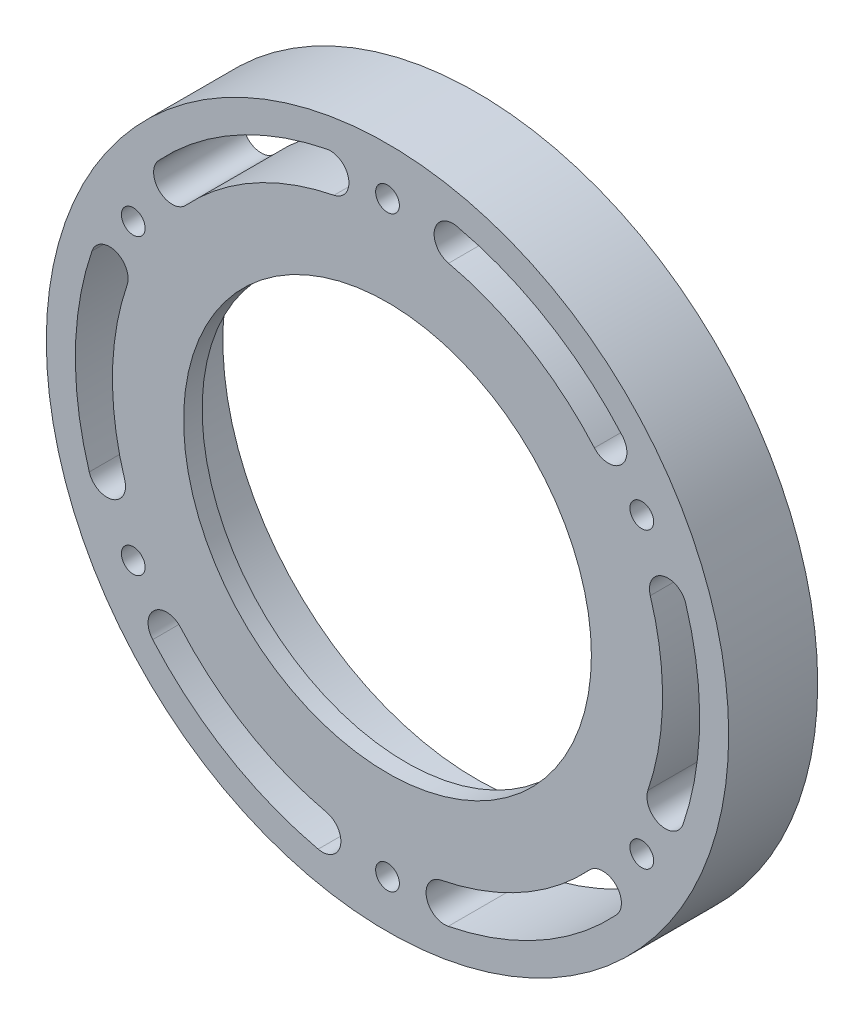
from build123d import *

# Parameters (mm, degrees)
SKETCH_1_R      = 46
SKETCH_1_R_2    = 34.2
SKETCH_1_R_3    = 1.6
EXTRUDE_1_DEPTH = 12
EXTRUDE_START   = -2.5
SKETCH_4_R      = 34.2
SKETCH_4_R_2    = 27.488330285
EXTRUDE_2_DEPTH = 2.5


with BuildPart() as part:
    # 草图1 → 凸台-拉伸1 (new body)
    with BuildSketch(Plane.XY):
        Circle(SKETCH_1_R)
        Circle(SKETCH_1_R_2, mode=Mode.SUBTRACT)
        with Locations((0, 39.58306587)):
            Circle(SKETCH_1_R_3, mode=Mode.SUBTRACT)
        with Locations((34.279940603, 19.791532935)):
            Circle(SKETCH_1_R_3, mode=Mode.SUBTRACT)
        with Locations((34.279940603, -19.791532935)):
            Circle(SKETCH_1_R_3, mode=Mode.SUBTRACT)
        with Locations((0, -39.58306587)):
            Circle(SKETCH_1_R_3, mode=Mode.SUBTRACT)
        with Locations((-34.279940603, -19.791532935)):
            Circle(SKETCH_1_R_3, mode=Mode.SUBTRACT)
        with Locations((-34.279940603, 19.791532935)):
            Circle(SKETCH_1_R_3, mode=Mode.SUBTRACT)
        with BuildLine():
            ThreePointArc((-8.185543448, 41.279308515), (-20.527703984, 36.736872515), (-30.865032605, 28.606541127))
            ThreePointArc((-30.865032605, 28.606541127), (-30.730863942, 25.073553897), (-27.197876712, 25.20772256))
            ThreePointArc((-27.197876712, 25.20772256), (-18.088753356, 32.372067841), (-7.212997452, 36.374805045))
            ThreePointArc((-7.212997452, 36.374805045), (-5.247018715, 39.313329778), (-8.185543448, 41.279308515))
        make_face(mode=Mode.SUBTRACT)
        with BuildLine():
            ThreePointArc((31.6561581, 27.728542827), (21.551212861, 36.145949389), (9.341475028, 41.033172889))
            ThreePointArc((9.341475028, 41.033172889), (6.348902667, 39.150485803), (8.231589753, 36.157913442))
            ThreePointArc((8.231589753, 36.157913442), (18.990656446, 31.85135385), (27.895006501, 24.434041553))
            ThreePointArc((27.895006501, 24.434041553), (31.422832938, 24.200716391), (31.6561581, 27.728542827))
        make_face(mode=Mode.SUBTRACT)
        with BuildLine():
            ThreePointArc((39.841701549, -13.550765687), (42.078916845, -0.590923126), (40.206507633, 12.426631761))
            ThreePointArc((40.206507633, 12.426631761), (37.079766609, 14.076931906), (35.429466465, 10.950190881))
            ThreePointArc((35.429466465, 10.950190881), (37.079409802, -0.520713992), (35.108003953, -11.940763492))
            ThreePointArc((35.108003953, -11.940763492), (36.669851653, -15.112613388), (39.841701549, -13.550765687))
        make_face(mode=Mode.SUBTRACT)
        with BuildLine():
            ThreePointArc((8.185543448, -41.279308515), (20.527703984, -36.736872515), (30.865032605, -28.606541127))
            ThreePointArc((30.865032605, -28.606541127), (30.730863942, -25.073553897), (27.197876712, -25.20772256))
            ThreePointArc((27.197876712, -25.20772256), (18.088753356, -32.372067841), (7.212997452, -36.374805045))
            ThreePointArc((7.212997452, -36.374805045), (5.247018715, -39.313329778), (8.185543448, -41.279308515))
        make_face(mode=Mode.SUBTRACT)
        with BuildLine():
            ThreePointArc((-31.6561581, -27.728542827), (-21.551212861, -36.145949389), (-9.341475028, -41.033172889))
            ThreePointArc((-9.341475028, -41.033172889), (-6.348902667, -39.150485803), (-8.231589753, -36.157913442))
            ThreePointArc((-8.231589753, -36.157913442), (-18.990656446, -31.85135385), (-27.895006501, -24.434041553))
            ThreePointArc((-27.895006501, -24.434041553), (-31.422832938, -24.200716391), (-31.6561581, -27.728542827))
        make_face(mode=Mode.SUBTRACT)
        with BuildLine():
            ThreePointArc((-39.841701549, 13.550765687), (-42.078916845, 0.590923126), (-40.206507633, -12.426631761))
            ThreePointArc((-40.206507633, -12.426631761), (-37.079766609, -14.076931906), (-35.429466465, -10.950190881))
            ThreePointArc((-35.429466465, -10.950190881), (-37.079409802, 0.520713992), (-35.108003953, 11.940763492))
            ThreePointArc((-35.108003953, 11.940763492), (-36.669851653, 15.112613388), (-39.841701549, 13.550765687))
        make_face(mode=Mode.SUBTRACT)
    extrude(amount=EXTRUDE_1_DEPTH)

    # 草图4 → 凸台-拉伸2 (add)
    with BuildSketch(Plane.XY.offset(12).offset(EXTRUDE_START)):
        Circle(SKETCH_4_R)
        Circle(SKETCH_4_R_2, mode=Mode.SUBTRACT)
    extrude(amount=EXTRUDE_2_DEPTH)


solid = part.part
